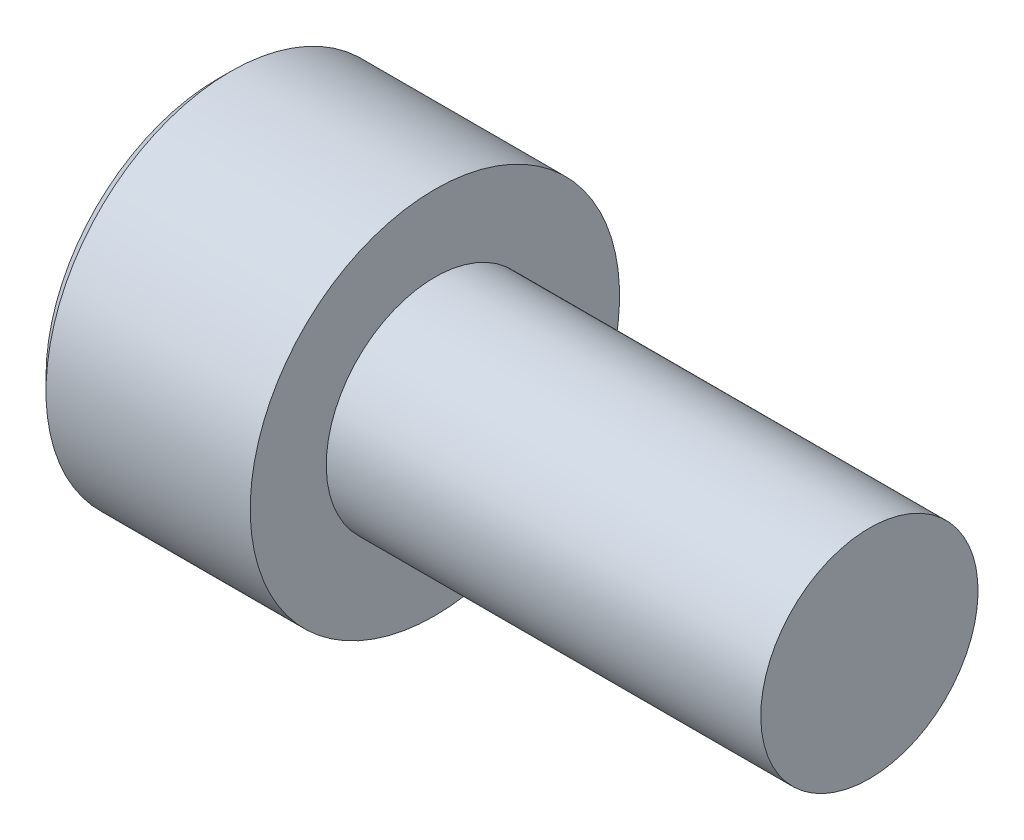
from build123d import *

# Parameters (mm, degrees)
CUT_EXTRUDE1_DEPTH = 2
CHAMFER1_SIZE      = 0.3


with BuildPart() as part:
    # Sketch1 → Revolve1 (revolve)
    with BuildSketch(Plane.XY, mode=Mode.PRIVATE) as revolve1_sk:
        Polygon((0, 2.5), (0, 4.25), (-5, 4.25), (-5, 0), (10, 0), (10, 2.5), align=None)
    revolve(revolve1_sk.sketch.rotate(Axis((-5, 0, 0), (1, 0, 0)), 180), axis=Axis((-5, 0, 0), (1, 0, 0)))

    # Sketch2 → Cut-Revolve1 (revolve, cut)
    with BuildSketch(Plane.XY, mode=Mode.PRIVATE) as cut_revolve1_sk:
        Polygon((-5, 0), (-1.845299462, 0), (-3, 2), (-5, 2), align=None)
    revolve(cut_revolve1_sk.sketch.rotate(Axis((0, 0, 0), (-1, 0, 0)), 180), axis=Axis((0, 0, 0), (-1, 0, 0)), mode=Mode.SUBTRACT)

    # Sketch3 → Cut-Extrude1 (cut)
    with BuildSketch(Plane.ZY.offset(5)):
        Polygon((2.309401077, 0), (1.154700538, 2), (-1.154700538, 2), (-2.309401077, 0), (-1.154700538, -2), (1.154700538, -2), align=None)
    extrude(amount=-CUT_EXTRUDE1_DEPTH, mode=Mode.SUBTRACT)

    # Chamfer1
    chamfer1_edges = [part.edges().sort_by_distance(p)[0] for p in [
        (-5, 4.25, 0),
    ]]
    chamfer(chamfer1_edges, length=CHAMFER1_SIZE)


solid = part.part
